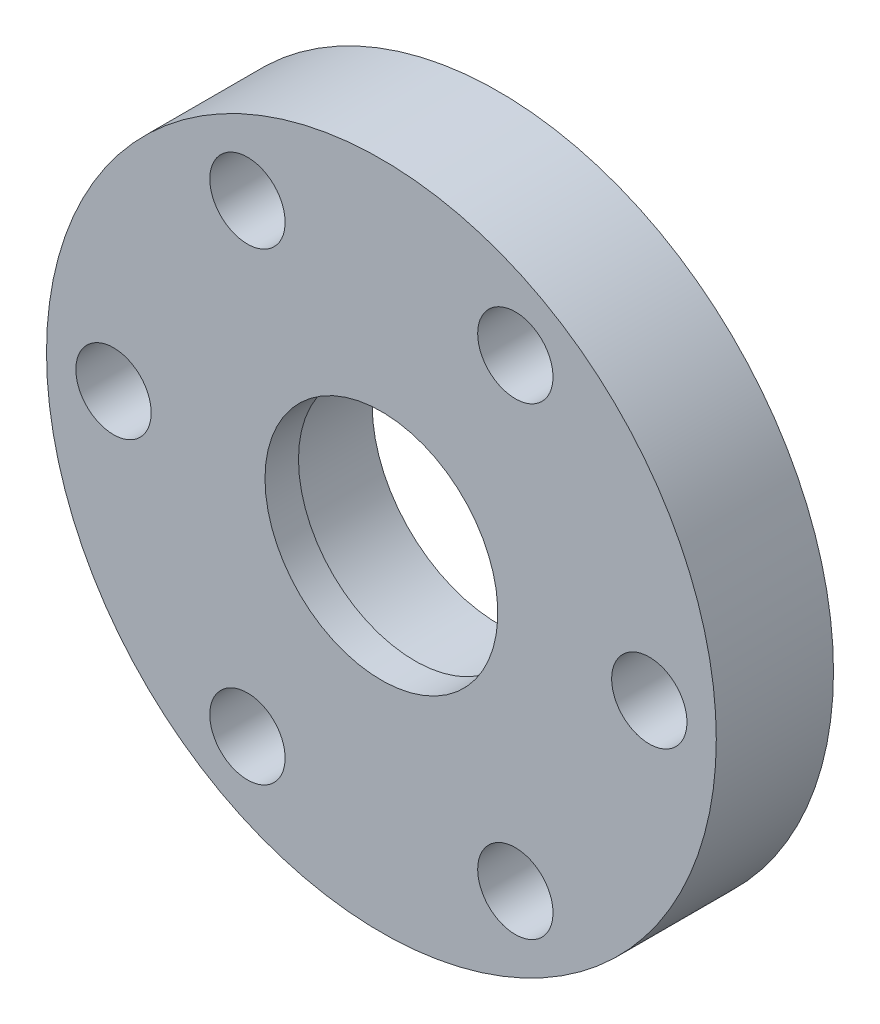
from build123d import *

# Parameters (mm, degrees)
SKETCH1_R           = 20.0025
SKETCH1_R_2         = 7.55
BOSS_EXTRUDE1_DEPTH = 7
SKETCH2_R           = 7.55
SKETCH2_R_2         = 6.952615
BOSS_EXTRUDE2_DEPTH = 2
SKETCH3_R           = 2.25
CUT_EXTRUDE1_DEPTH  = 7


with BuildPart() as part:
    # Sketch1 → Boss-Extrude1 (new body)
    with BuildSketch(Plane(origin=(0, 0, -43.4), x_dir=(-1, 0, 0), z_dir=(0, 0, -1))):
        with Locations(Location((0, 0, 0), (0, 0, 180))):
            Circle(SKETCH1_R)
        with Locations(Location((0, 0, 0), (0, 0, 180))):
            Circle(SKETCH1_R_2, mode=Mode.SUBTRACT)
    extrude(amount=BOSS_EXTRUDE1_DEPTH)

    # Sketch2 → Boss-Extrude2 (add)
    with BuildSketch(Plane(origin=(0, 0, -43.4), x_dir=(-1, 0, 0), z_dir=(0, 0, -1))):
        with Locations(Location((0, 0, 0), (0, 0, 180))):
            Circle(SKETCH2_R)
        Circle(SKETCH2_R_2, mode=Mode.SUBTRACT)
    extrude(amount=BOSS_EXTRUDE2_DEPTH)

    # Sketch3 → Cut-Extrude1 (cut)
    with BuildSketch(Plane(origin=(0, 0, -50.4), x_dir=(-1, 0, 0), z_dir=(0, 0, -1))):
        with Locations((16, 0)):
            Circle(SKETCH3_R)
        with Locations((8, -13.856406461)):
            Circle(SKETCH3_R)
        with Locations((-8, -13.856406461)):
            Circle(SKETCH3_R)
        with Locations((-16, 0)):
            Circle(SKETCH3_R)
        with Locations((-8, 13.856406461)):
            Circle(SKETCH3_R)
        with Locations((8, 13.856406461)):
            Circle(SKETCH3_R)
    extrude(amount=-CUT_EXTRUDE1_DEPTH, mode=Mode.SUBTRACT)


solid = part.part
